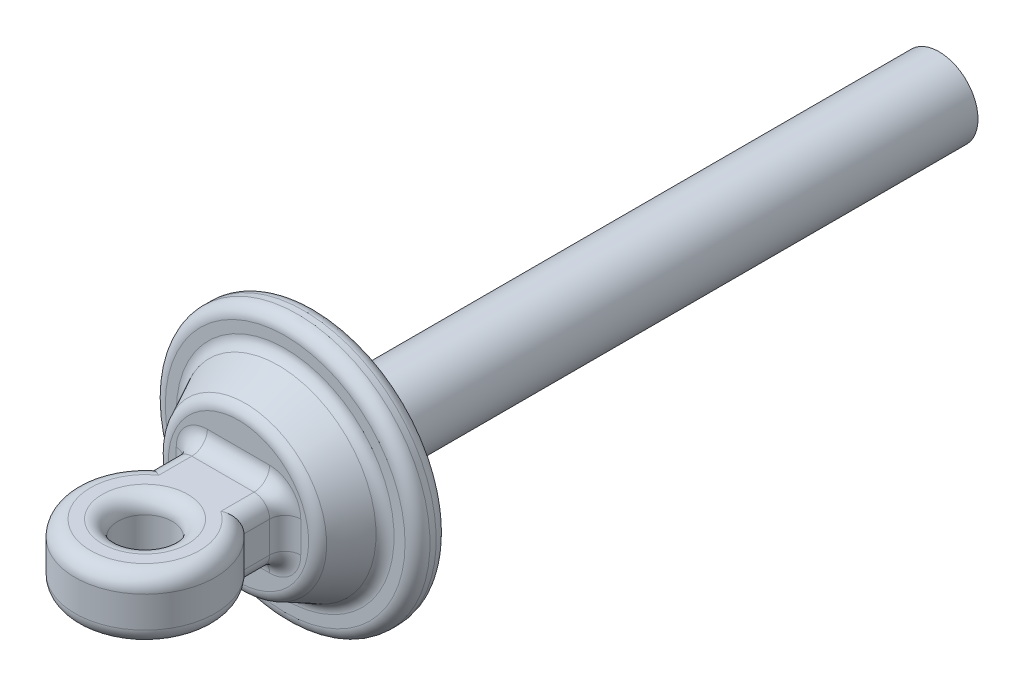
from build123d import *

# Parameters (mm, degrees)
SKETCH_2_R      = 2.5
EXTRUDE_1_DEPTH = 40
SKETCH_8_R      = 1.75
EXTRUDE_4_DEPTH = 2
FILLET_2_R      = 1


with BuildPart() as part:
    # 草图2 → 凸台-拉伸1 (new body)
    with BuildSketch(Plane.XY):
        Circle(SKETCH_2_R)
    extrude(amount=EXTRUDE_1_DEPTH)

    # 草图6 → 旋转2 (revolve)
    with BuildSketch(Plane(origin=(0, 0, 0), x_dir=(1, 0, 0), z_dir=(0, 1, 0)), mode=Mode.PRIVATE) as revolve_2_sk:
        with BuildLine():
            Line((0, -40), (7.7, -40))
            ThreePointArc((7.7, -40), (8.265685425, -40.234314575), (8.5, -40.8))
            Line((8.5, -40.8), (8.5, -41.2))
            ThreePointArc((8.5, -41.2), (8.265685425, -41.765685425), (7.7, -42))
            Line((7.7, -42), (6.994427191, -42))
            ThreePointArc((6.994427191, -42), (6.573842301, -42.119479353), (6.278885438, -42.442229124))
            Line((6.278885438, -42.442229124), (5.221114562, -44.557770876))
            ThreePointArc((5.221114562, -44.557770876), (4.926157699, -44.880520647), (4.505572809, -45))
            Line((4.505572809, -45), (0, -45))
            Line((0, -45), (0, -42))
            Line((0, -42), (0, -40))
        make_face()
    revolve(revolve_2_sk.sketch.rotate(Axis((0, 0, 40), (0, 0, 1)), 180), axis=Axis((0, 0, 40), (0, 0, 1)))

    # 草图8 → 凸台-拉伸4 (add, symmetric)
    with BuildSketch(Plane(origin=(0, 0, 0), x_dir=(1, 0, 0), z_dir=(0, 1, 0))):
        with BuildLine():
            Line((-3, -45), (-3, -47.645898034))
            ThreePointArc((-3, -47.645898034), (0, -55.5), (3, -47.645898034))
            Line((3, -47.645898034), (3, -45))
            Line((3, -45), (-3, -45))
        make_face()
        with Locations(Location((0, -51, 0), (0, 0, 270))):
            Circle(SKETCH_8_R, mode=Mode.SUBTRACT)
    extrude(amount=EXTRUDE_4_DEPTH, both=True)

    # 圆角2
    fillet_2_edges = [part.edges().sort_by_distance(p)[0] for p in [
        (-3, 2, 46.322949017),
        (0, 2, 55.5),
        (0, -2, 45),
        (3, -2, 46.322949017),
        (0, -2, 49.25),
        (-3, -2, 46.322949017),
        (-3, 0, 45),
        (0, -2, 55.5),
        (3, 2, 46.322949017),
        (0, 2, 45),
        (3, 0, 45),
        (0, 2, 49.25),
    ]]
    fillet(fillet_2_edges, radius=FILLET_2_R)


solid = part.part
